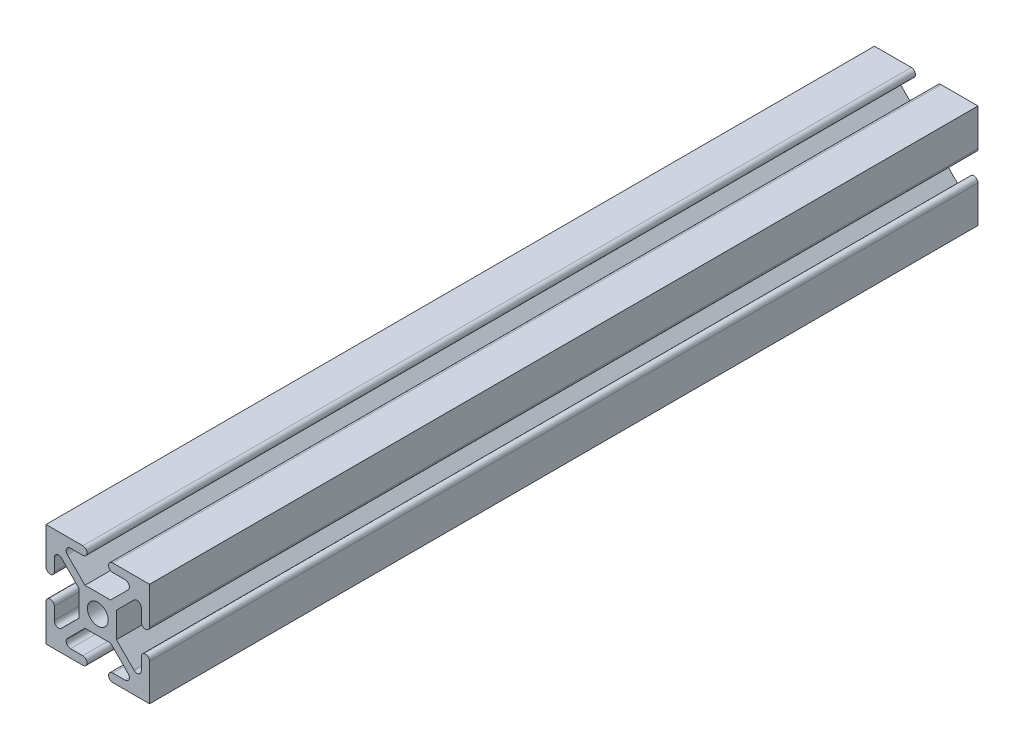
from build123d import *

# Parameters (mm, degrees)
SKETCH2_R           = 2.5
BOSS_EXTRUDE1_DEPTH = 200


with BuildPart() as part:
    # Sketch2 → Boss-Extrude1 (new body)
    with BuildSketch(Plane.XY):
        with BuildLine():
            ThreePointArc((16.100505063, 0), (15.100505063, 1), (16.100505063, 2))
            Line((16.100505063, 2), (19.100505063, 2))
            ThreePointArc((19.100505063, 2), (20.05158107, 2.635488671), (19.828427125, 3.757359313))
            Line((19.828427125, 3.757359313), (15.585786438, 8))
            Line((15.585786438, 8), (12.5, 8))
            Line((12.5, 8), (9.414213562, 8))
            Line((9.414213562, 8), (5.171572875, 3.757359313))
            ThreePointArc((5.171572875, 3.757359313), (4.94841893, 2.635488671), (5.899494937, 2))
            Line((5.899494937, 2), (8.899494937, 2))
            ThreePointArc((8.899494937, 2), (9.899494937, 1), (8.899494937, 0))
            Line((8.899494937, 0), (0, 0))
            Line((0, 0), (0, 8.899494937))
            ThreePointArc((0, 8.899494937), (1, 9.899494937), (2, 8.899494937))
            Line((2, 8.899494937), (2, 5.899494937))
            ThreePointArc((2, 5.899494937), (2.635488671, 4.94841893), (3.757359313, 5.171572875))
            Line((3.757359313, 5.171572875), (8, 9.414213562))
            Line((8, 9.414213562), (8, 12.5))
            Line((8, 12.5), (8, 15.585786438))
            Line((8, 15.585786438), (3.757359313, 19.828427125))
            ThreePointArc((3.757359313, 19.828427125), (2.635488671, 20.05158107), (2, 19.100505063))
            Line((2, 19.100505063), (2, 16.100505063))
            ThreePointArc((2, 16.100505063), (1, 15.100505063), (0, 16.100505063))
            Line((0, 16.100505063), (0, 25))
            Line((0, 25), (8.899494937, 25))
            ThreePointArc((8.899494937, 25), (9.899494937, 24), (8.899494937, 23))
            Line((8.899494937, 23), (5.899494937, 23))
            ThreePointArc((5.899494937, 23), (4.94841893, 22.364511329), (5.171572875, 21.242640687))
            Line((5.171572875, 21.242640687), (9.414213562, 17))
            Line((9.414213562, 17), (12.5, 17))
            Line((12.5, 17), (15.585786438, 17))
            Line((15.585786438, 17), (19.828427125, 21.242640687))
            ThreePointArc((19.828427125, 21.242640687), (20.05158107, 22.364511329), (19.100505063, 23))
            Line((19.100505063, 23), (16.100505063, 23))
            ThreePointArc((16.100505063, 23), (15.100505063, 24), (16.100505063, 25))
            Line((16.100505063, 25), (25, 25))
            Line((25, 25), (25, 16.100505063))
            ThreePointArc((25, 16.100505063), (24, 15.100505063), (23, 16.100505063))
            Line((23, 16.100505063), (23, 19.100505063))
            ThreePointArc((23, 19.100505063), (22.364511329, 20.05158107), (21.242640687, 19.828427125))
            Line((21.242640687, 19.828427125), (17, 15.585786438))
            Line((17, 15.585786438), (17, 12.5))
            Line((17, 12.5), (17, 9.414213562))
            Line((17, 9.414213562), (21.242640687, 5.171572875))
            ThreePointArc((21.242640687, 5.171572875), (22.364511329, 4.94841893), (23, 5.899494937))
            Line((23, 5.899494937), (23, 8.899494937))
            ThreePointArc((23, 8.899494937), (24, 9.899494937), (25, 8.899494937))
            Line((25, 8.899494937), (25, 0))
            Line((25, 0), (16.100505063, 0))
        make_face()
        with Locations((12.5, 12.5)):
            Circle(SKETCH2_R, mode=Mode.SUBTRACT)
    extrude(amount=BOSS_EXTRUDE1_DEPTH)


solid = part.part
